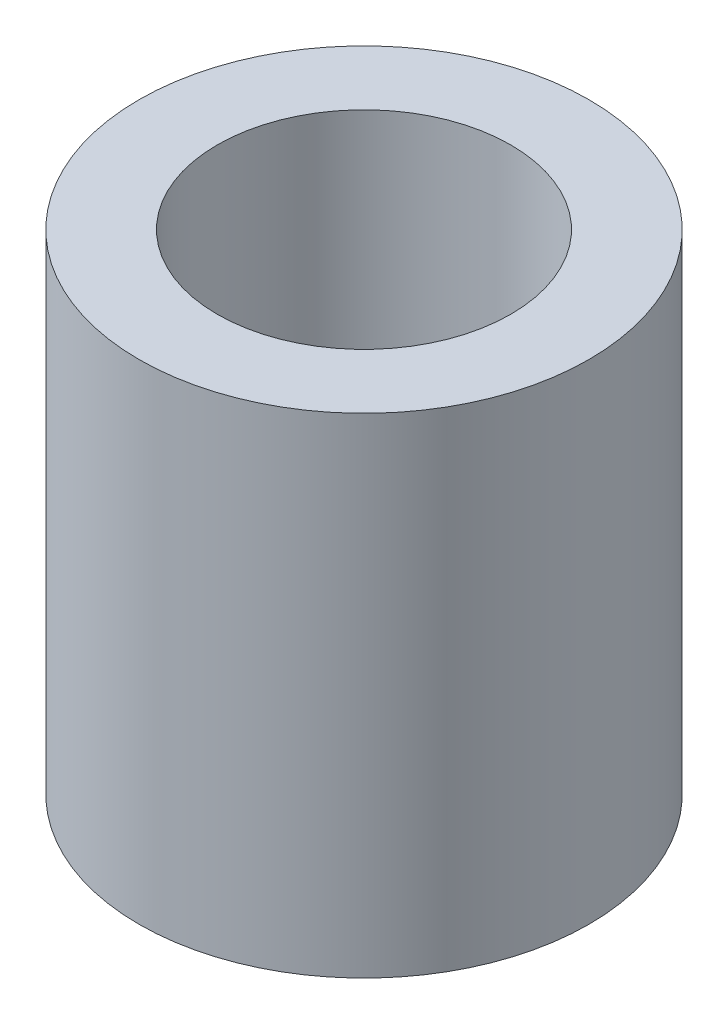
from build123d import *

# Parameters (mm, degrees)
SKETCH1_W = 0.8
SKETCH1_H = 5


with BuildPart() as part:
    # Sketch1 → Revolve1 (revolve)
    with BuildSketch(Plane.XY, mode=Mode.PRIVATE) as revolve1_sk:
        with Locations((-1.9, 2.5)):
            Rectangle(SKETCH1_W, SKETCH1_H)
    revolve(revolve1_sk.sketch.rotate(Axis((0, 0, 0), (0, 1, 0)), 270), axis=Axis((0, 0, 0), (0, 1, 0)))


solid = part.part
